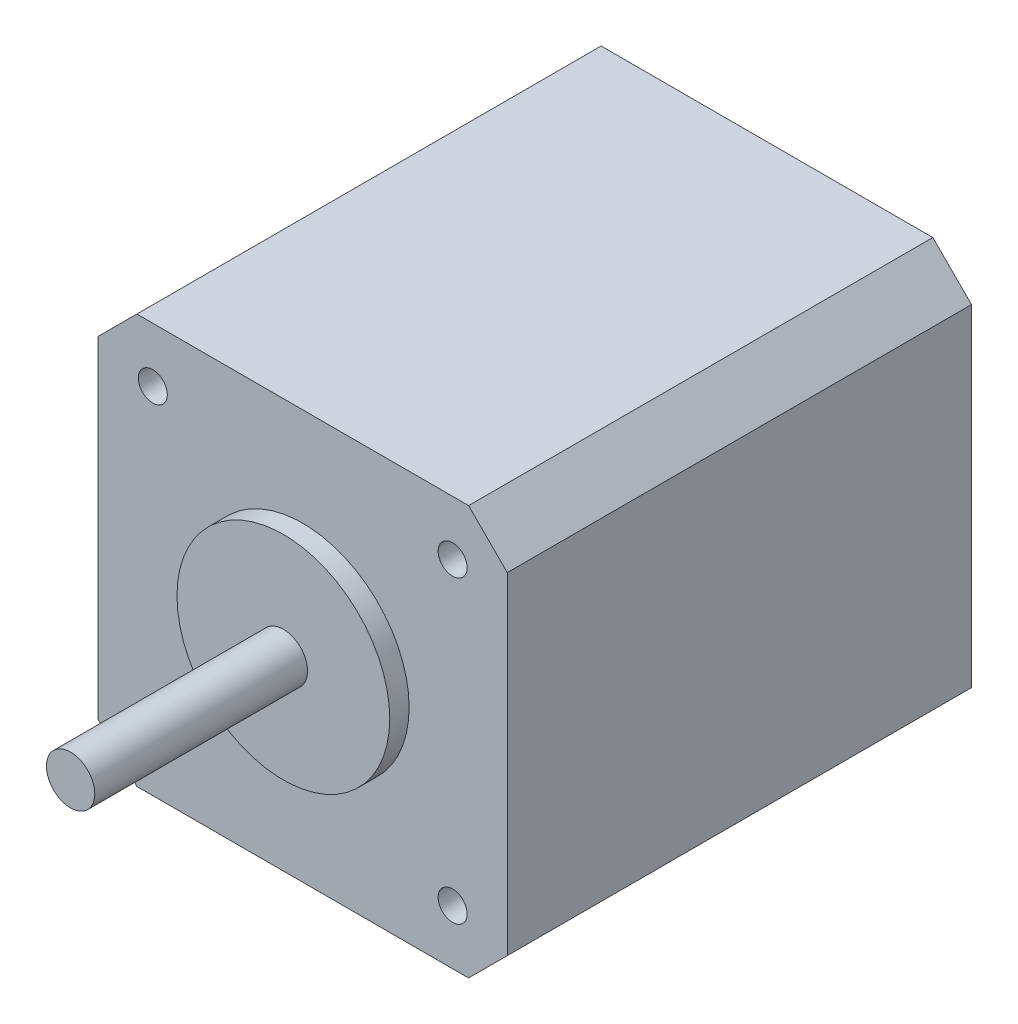
from build123d import *

# Parameters (mm, degrees)
SKETCH1_W           = 42.3
SKETCH1_H           = 42.3
BOSS_EXTRUDE1_DEPTH = 48
SKETCH2_R           = 1.5
CUT_EXTRUDE1_DEPTH  = 6
SKETCH3_R           = 11
BOSS_EXTRUDE2_DEPTH = 2
SKETCH4_R           = 2.5
BOSS_EXTRUDE3_DEPTH = 22
CHAMFER1_SIZE       = 4


with BuildPart() as part:
    # Sketch1 → Boss-Extrude1 (new body)
    with BuildSketch(Plane.XY):
        Rectangle(SKETCH1_W, SKETCH1_H)
    extrude(amount=-BOSS_EXTRUDE1_DEPTH)

    # Sketch2 → Cut-Extrude1 (cut)
    with BuildSketch(Plane.XY):
        with Locations((-15.5, 15.5)):
            Circle(SKETCH2_R)
        with Locations((15.5, 15.5)):
            Circle(SKETCH2_R)
        with Locations((15.5, -15.5)):
            Circle(SKETCH2_R)
        with Locations((-15.5, -15.5)):
            Circle(SKETCH2_R)
    extrude(amount=-CUT_EXTRUDE1_DEPTH, mode=Mode.SUBTRACT)

    # Sketch3 → Boss-Extrude2 (add)
    with BuildSketch(Plane.XY):
        Circle(SKETCH3_R)
    extrude(amount=BOSS_EXTRUDE2_DEPTH)

    # Sketch4 → Boss-Extrude3 (add)
    with BuildSketch(Plane.XY.offset(2)):
        Circle(SKETCH4_R)
    extrude(amount=BOSS_EXTRUDE3_DEPTH)

    # Chamfer1
    chamfer1_edges = [part.edges().sort_by_distance(p)[0] for p in [
        (21.15, -21.15, -24),
        (-21.15, -21.15, -24),
        (-21.15, 21.15, -24),
        (21.15, 21.15, -24),
    ]]
    chamfer(chamfer1_edges, length=CHAMFER1_SIZE)


solid = part.part
